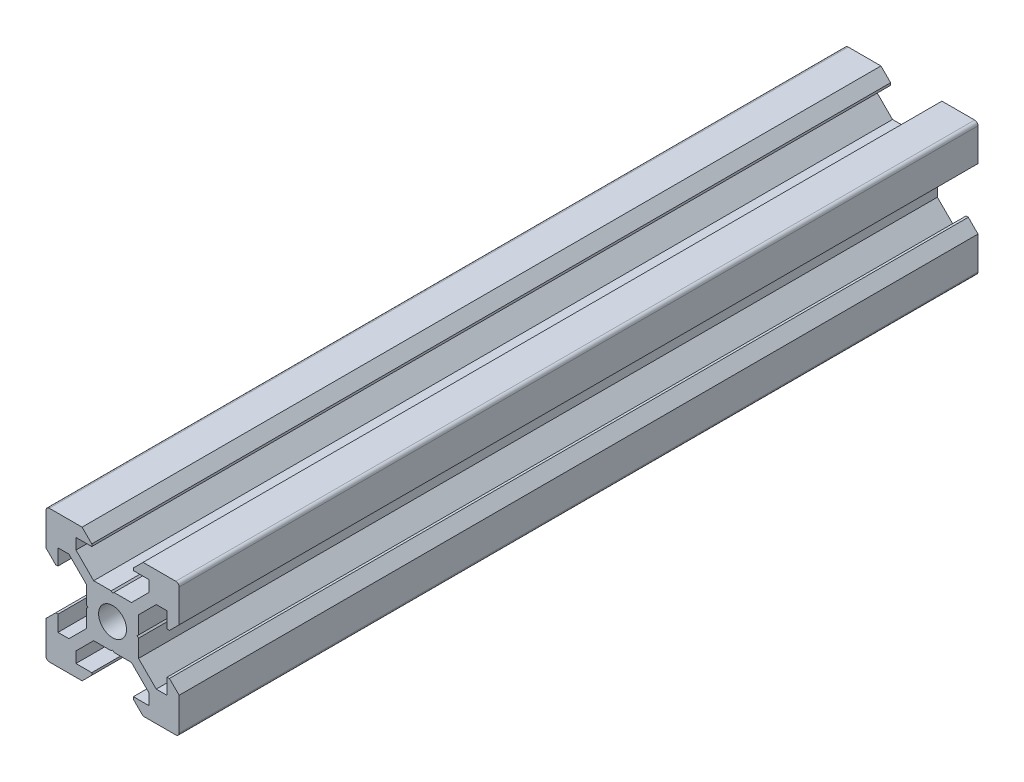
from build123d import *

# Parameters (mm, degrees)
SKETCH1_R           = 2.1
BOSS_EXTRUDE1_DEPTH = 120


with BuildPart() as part:
    # Sketch1 → Boss-Extrude1 (new body)
    with BuildSketch(Plane.XY):
        with BuildLine():
            Line((4.58, -10), (9.5, -10))
            ThreePointArc((9.5, -10), (9.853553391, -9.853553391), (10, -9.5))
            Line((10, -9.5), (10, -4.58))
            Line((10, -4.58), (8.545, -3.125))
            Line((8.545, -3.125), (8.2, -3.125))
            Line((8.2, -3.125), (8.2, -5.5))
            Line((8.2, -5.5), (6.560660172, -5.5))
            Line((6.560660172, -5.5), (3.9, -2.839339828))
            Line((3.9, -2.839339828), (3.9, -0.21))
            Line((3.9, -0.21), (3.69, 0))
            Line((3.69, 0), (3.9, 0.21))
            Line((3.9, 0.21), (3.9, 2.839339828))
            Line((3.9, 2.839339828), (6.560660172, 5.5))
            Line((6.560660172, 5.5), (8.2, 5.5))
            Line((8.2, 5.5), (8.2, 3.125))
            Line((8.2, 3.125), (8.545, 3.125))
            Line((8.545, 3.125), (10, 4.58))
            Line((10, 4.58), (10, 9.5))
            ThreePointArc((10, 9.5), (9.853553391, 9.853553391), (9.5, 10))
            Line((9.5, 10), (4.58, 10))
            Line((4.58, 10), (3.125, 8.545))
            Line((3.125, 8.545), (3.125, 8.2))
            Line((3.125, 8.2), (5.5, 8.2))
            Line((5.5, 8.2), (5.5, 6.560660172))
            Line((5.5, 6.560660172), (2.839339828, 3.9))
            Line((2.839339828, 3.9), (0.21, 3.9))
            Line((0.21, 3.9), (0, 3.69))
            Line((0, 3.69), (-0.21, 3.9))
            Line((-0.21, 3.9), (-2.839339828, 3.9))
            Line((-2.839339828, 3.9), (-5.5, 6.560660172))
            Line((-5.5, 6.560660172), (-5.5, 8.2))
            Line((-5.5, 8.2), (-3.125, 8.2))
            Line((-3.125, 8.2), (-3.125, 8.545))
            Line((-3.125, 8.545), (-4.58, 10))
            Line((-4.58, 10), (-9.5, 10))
            ThreePointArc((-9.5, 10), (-9.853553391, 9.853553391), (-10, 9.5))
            Line((-10, 9.5), (-10, 4.58))
            Line((-10, 4.58), (-8.545, 3.125))
            Line((-8.545, 3.125), (-8.2, 3.125))
            Line((-8.2, 3.125), (-8.2, 5.5))
            Line((-8.2, 5.5), (-6.560660172, 5.5))
            Line((-6.560660172, 5.5), (-3.9, 2.839339828))
            Line((-3.9, 2.839339828), (-3.9, 0.21))
            Line((-3.9, 0.21), (-3.69, 0))
            Line((-3.69, 0), (-3.9, -0.21))
            Line((-3.9, -0.21), (-3.9, -2.839339828))
            Line((-3.9, -2.839339828), (-6.560660172, -5.5))
            Line((-6.560660172, -5.5), (-8.2, -5.5))
            Line((-8.2, -5.5), (-8.2, -3.125))
            Line((-8.2, -3.125), (-8.545, -3.125))
            Line((-8.545, -3.125), (-10, -4.58))
            Line((-10, -4.58), (-10, -9.5))
            ThreePointArc((-10, -9.5), (-9.853553391, -9.853553391), (-9.5, -10))
            Line((-9.5, -10), (-4.58, -10))
            Line((-4.58, -10), (-3.125, -8.545))
            Line((-3.125, -8.545), (-3.125, -8.2))
            Line((-3.125, -8.2), (-5.5, -8.2))
            Line((-5.5, -8.2), (-5.5, -6.560660172))
            Line((-5.5, -6.560660172), (-2.839339828, -3.9))
            Line((-2.839339828, -3.9), (-0.21, -3.9))
            Line((-0.21, -3.9), (0, -3.69))
            Line((0, -3.69), (0.21, -3.9))
            Line((0.21, -3.9), (2.839339828, -3.9))
            Line((2.839339828, -3.9), (5.5, -6.560660172))
            Line((5.5, -6.560660172), (5.5, -8.2))
            Line((5.5, -8.2), (3.125, -8.2))
            Line((3.125, -8.2), (3.125, -8.545))
            Line((3.125, -8.545), (4.58, -10))
        make_face()
        Circle(SKETCH1_R, mode=Mode.SUBTRACT)
    extrude(amount=BOSS_EXTRUDE1_DEPTH)


solid = part.part
